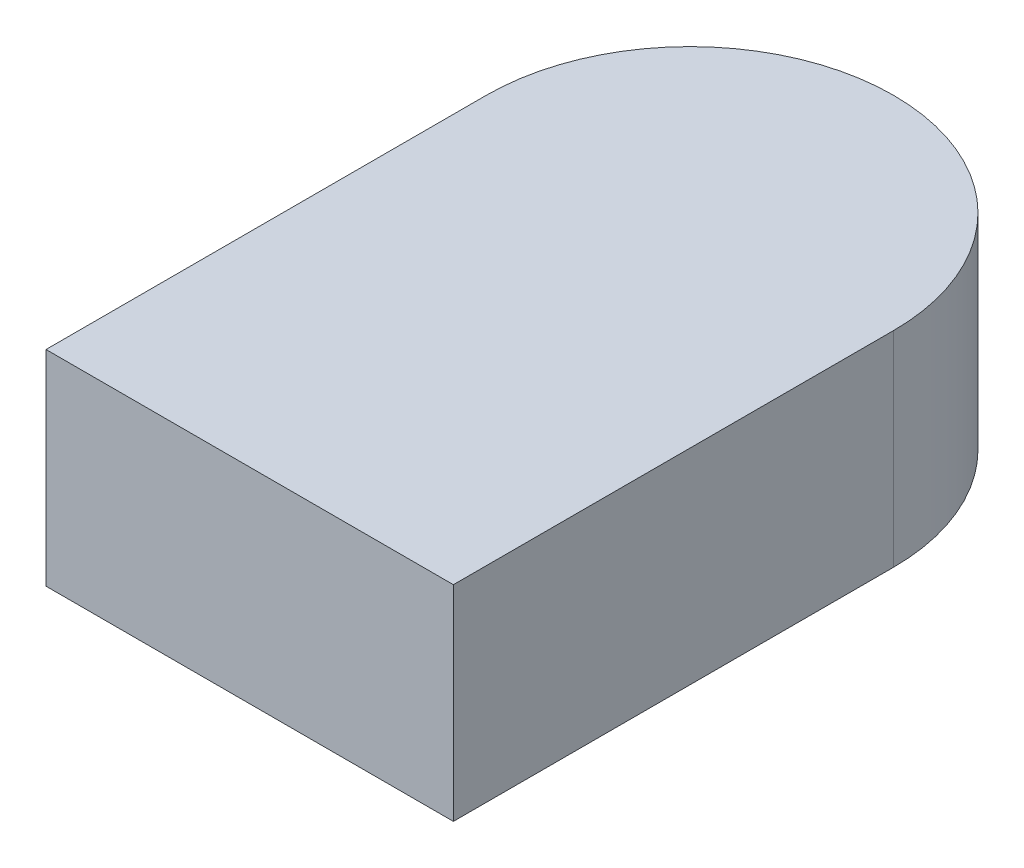
from build123d import *

# Parameters (mm, degrees)
BOSS_EXTRUDE1_DEPTH = 15.6


with BuildPart() as part:
    # Sketch1 → Boss-Extrude1 (new body)
    with BuildSketch(Plane(origin=(0, 0, 0), x_dir=(1, 0, 0), z_dir=(0, 1, 0))):
        with BuildLine():
            Line((-15.5, 0), (-15.5, -33.5))
            Line((-15.5, -33.5), (15.5, -33.5))
            Line((15.5, -33.5), (15.5, 0))
            ThreePointArc((15.5, 0), (0, 15.5), (-15.5, 0))
        make_face()
    extrude(amount=BOSS_EXTRUDE1_DEPTH)


solid = part.part
